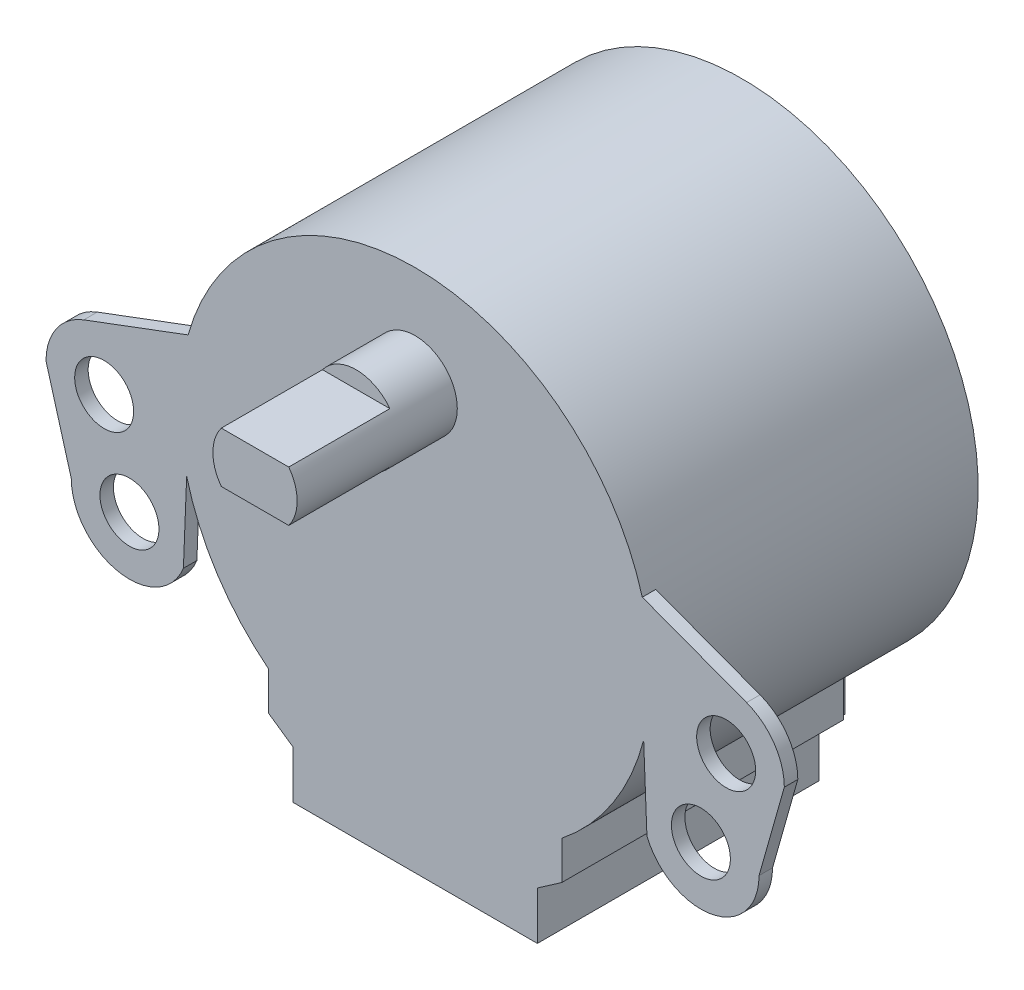
from build123d import *

# Parameters (mm, degrees)
HOUSING_BOSS_EXTRUDE1_DEPTH           = 19.4
PLASTIC_SHEILDING_BOSS_EXTRUDE2_DEPTH = 16.7
SKETCH5_R                             = 1.75
MOUNTING_BRACKETS_BOSS_EXTRUDE3_DEPTH = 0.8
SKETCH6_R                             = 2.5
SHAFT_BOSS_EXTRUDE4_DEPTH             = 9.5
SHAFT_START                           = -6
SHAFT_EDGECUT_EXTRUDE1_DEPTH          = 6
CABLE_HOLE_CUT_EXTRUDE2_DEPTH         = 5


with BuildPart() as part:
    # Sketch2 → Housing Boss-Extrude1 (new body)
    with BuildSketch(Plane.XY):
        with BuildLine():
            Line((-6.1, -15.60119042), (0, -15.60119042))
            Line((0, -15.60119042), (6.1, -15.60119042))
            Line((6.1, -15.60119042), (6.1, -12.60119042))
            ThreePointArc((6.1, -12.60119042), (0, 14), (-6.1, -12.60119042))
            Line((-6.1, -12.60119042), (-6.1, -15.60119042))
        make_face()
    extrude(amount=-HOUSING_BOSS_EXTRUDE1_DEPTH)

    # Sketch4 → Plastic Sheilding Boss-Extrude2 (add)
    with BuildSketch(Plane.XY):
        with BuildLine():
            Line((0, -17.10119042), (-7.25, -17.10119042))
            Line((-7.25, -17.10119042), (-7.25, -14.253185025))
            Line((-7.25, -14.253185025), (-8.7, -13.245236981))
            Line((-8.7, -13.245236981), (-8.7, -10.968591523))
            ThreePointArc((-8.7, -10.968591523), (-7.444887158, -11.856376142), (-6.1, -12.60119042))
            Line((-6.1, -12.60119042), (-6.1, -15.60119042))
            Line((-6.1, -15.60119042), (6.1, -15.60119042))
            Line((6.1, -15.60119042), (6.1, -12.60119042))
            ThreePointArc((6.1, -12.60119042), (7.444887158, -11.856376142), (8.7, -10.968591523))
            Line((8.7, -10.968591523), (8.7, -13.245236981))
            Line((8.7, -13.245236981), (7.25, -14.253185025))
            Line((7.25, -14.253185025), (7.25, -17.10119042))
            Line((7.25, -17.10119042), (0, -17.10119042))
        make_face()
    extrude(amount=-PLASTIC_SHEILDING_BOSS_EXTRUDE2_DEPTH)

    # Sketch5 → Mounting Brackets Boss-Extrude3 (add)
    # profile 1 of 2: a face of its own
    with BuildSketch(Plane.XY):
        with BuildLine():
            Line((13.47442021, 3.8), (19.661172606, 1.480411881))
            ThreePointArc((19.661172606, 1.480411881), (21.285581553, 0.215191404), (21.9, -1.75))
            Line((21.9, -1.75), (20.4, -7.041502622))
            ThreePointArc((20.4, -7.041502622), (17.605339359, -10.428688818), (13.748967928, -8.328317944))
            Line((13.748967928, -8.328317944), (13.555441712, -3.5))
            ThreePointArc((13.555441712, -3.5), (13.999137791, 0.155374132), (13.47442021, 3.8))
        make_face()
        with Locations((18.45, -1.75)):
            Circle(SKETCH5_R, mode=Mode.SUBTRACT)
        with Locations((16.95, -7.041502622)):
            Circle(SKETCH5_R, mode=Mode.SUBTRACT)
    # profile 2 of 2: a face of its own
    with BuildSketch(Plane.XY):
        with BuildLine():
            Line((-13.748967928, -8.328317944), (-13.555441712, -3.5))
            ThreePointArc((-13.555441712, -3.5), (-13.999137791, 0.155374132), (-13.47442021, 3.8))
            Line((-13.47442021, 3.8), (-19.661172606, 1.480411881))
            ThreePointArc((-19.661172606, 1.480411881), (-21.285581553, 0.215191404), (-21.9, -1.75))
            Line((-21.9, -1.75), (-20.4, -7.041502622))
            ThreePointArc((-20.4, -7.041502622), (-17.605339359, -10.428688818), (-13.748967928, -8.328317944))
        make_face()
        with Locations(Location((-16.95, -7.041502622, 0), (0, 0, 180))):
            Circle(SKETCH5_R, mode=Mode.SUBTRACT)
        with Locations(Location((-18.45, -1.75, 0), (0, 0, 180))):
            Circle(SKETCH5_R, mode=Mode.SUBTRACT)
    extrude(amount=-MOUNTING_BRACKETS_BOSS_EXTRUDE3_DEPTH)

    # Sketch6 → Shaft Boss-Extrude4 (add)
    with BuildSketch(Plane.XY):
        with Locations((0, 8)):
            Circle(SKETCH6_R)
    extrude(amount=SHAFT_BOSS_EXTRUDE4_DEPTH)

    # Sketch7 → Shaft EdgeCut-Extrude1 (cut)
    with BuildSketch(Plane.XY.offset(9.5).offset(SHAFT_START)):
        with BuildLine():
            Line((-2, 9.5), (2, 9.5))
            ThreePointArc((2, 9.5), (0, 10.5), (-2, 9.5))
        make_face()
        with BuildLine():
            Line((-2, 6.5), (2, 6.5))
            ThreePointArc((2, 6.5), (0, 5.5), (-2, 6.5))
        make_face()
    extrude(amount=SHAFT_EDGECUT_EXTRUDE1_DEPTH, mode=Mode.SUBTRACT)

    # Sketch8 → Cable Hole Cut-Extrude2 (cut)
    with BuildSketch(Plane.XZ.offset(17.10119042)):
        Polygon((0, -2), (3.25, -2), (3.25, -3.2), (0, -3.2), (-3.25, -3.2), (-3.25, -2), align=None)
    extrude(amount=-CABLE_HOLE_CUT_EXTRUDE2_DEPTH, mode=Mode.SUBTRACT)


solid = part.part
